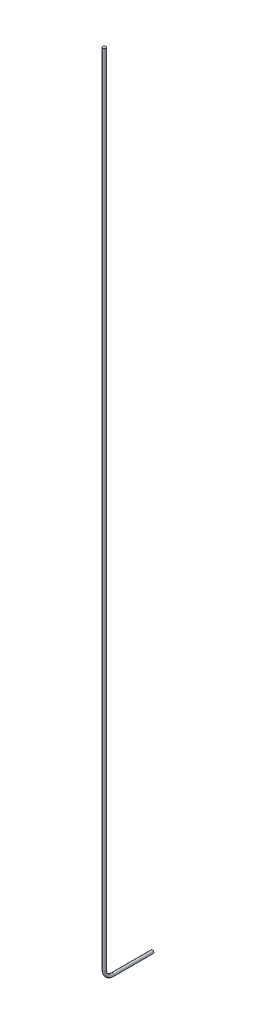
from build123d import *

# Parameters (mm, degrees)
SKETCH_1_R      = 0.98
EXTRUDE_1_DEPTH = 20
SKETCH_2_R      = 0.98


with BuildPart() as part:
    # ｽｹｯﾁ1 → ﾎﾞｽ - 押し出し1 (new body)
    with BuildSketch(Plane.XY):
        Circle(SKETCH_1_R)
    extrude(amount=EXTRUDE_1_DEPTH)

    # ｽｲｰﾌﾟ1: sweep along a path in ｽｹｯﾁ3
    with BuildLine(Plane(origin=(0, 0, 0), x_dir=(0, 0, -1), z_dir=(1, 0, 0))) as sweep_1_path:
        Line((-20, 0), (-25, 0))
        ThreePointArc((-25, 0), (-28.535533906, 1.464466094), (-30, 5))
        Line((-30, 5), (-30, 505))
    # ｽｹｯﾁ2 → ｽｲｰﾌﾟ1 (sweep)
    with BuildSketch(Plane.XY.offset(20)):
        Circle(SKETCH_2_R)
    sweep(path=sweep_1_path.line)


solid = part.part
